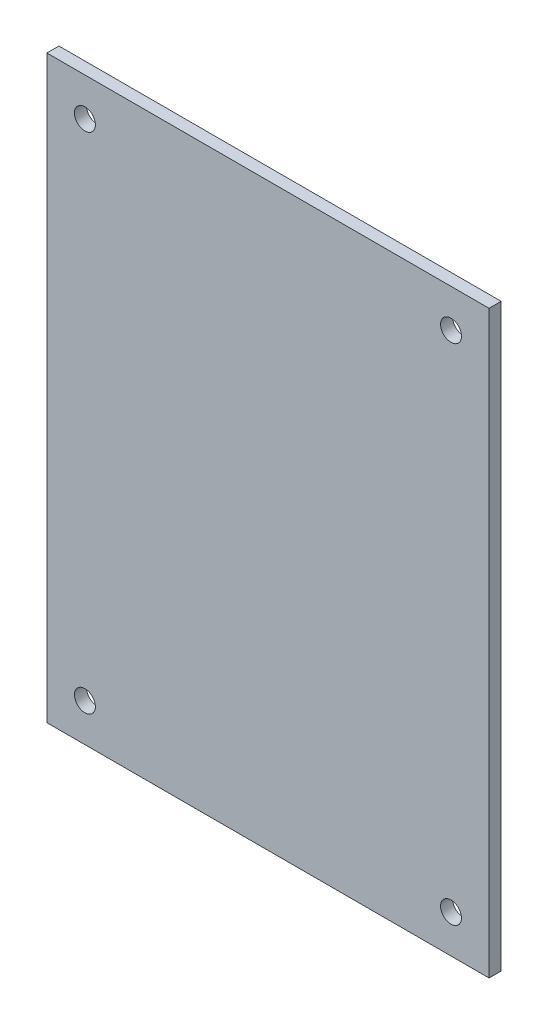
from build123d import *

# Parameters (mm, degrees)
SKETCH1_W            = 116.20000001
SKETCH1_H            = 152.4
BOSS_EXTRUDE1_DEPTH  = 3.175
M5_CLEARANCE_HOLE1_D = 5.5


with BuildPart() as part:
    # Sketch1 → Boss-Extrude1 (new body)
    with BuildSketch(Plane.XY):
        with Locations((58.100000005, 76.2)):
            Rectangle(SKETCH1_W, SKETCH1_H)
    extrude(amount=BOSS_EXTRUDE1_DEPTH)

    # M5 Clearance Hole1 (through all)
    with Locations(Plane.XY.offset(3.175)):
        with Locations((10, 142.4), (106.20000001, 142.4), (106.20000001, 10), (10, 10)):
            Hole(M5_CLEARANCE_HOLE1_D / 2)


solid = part.part
